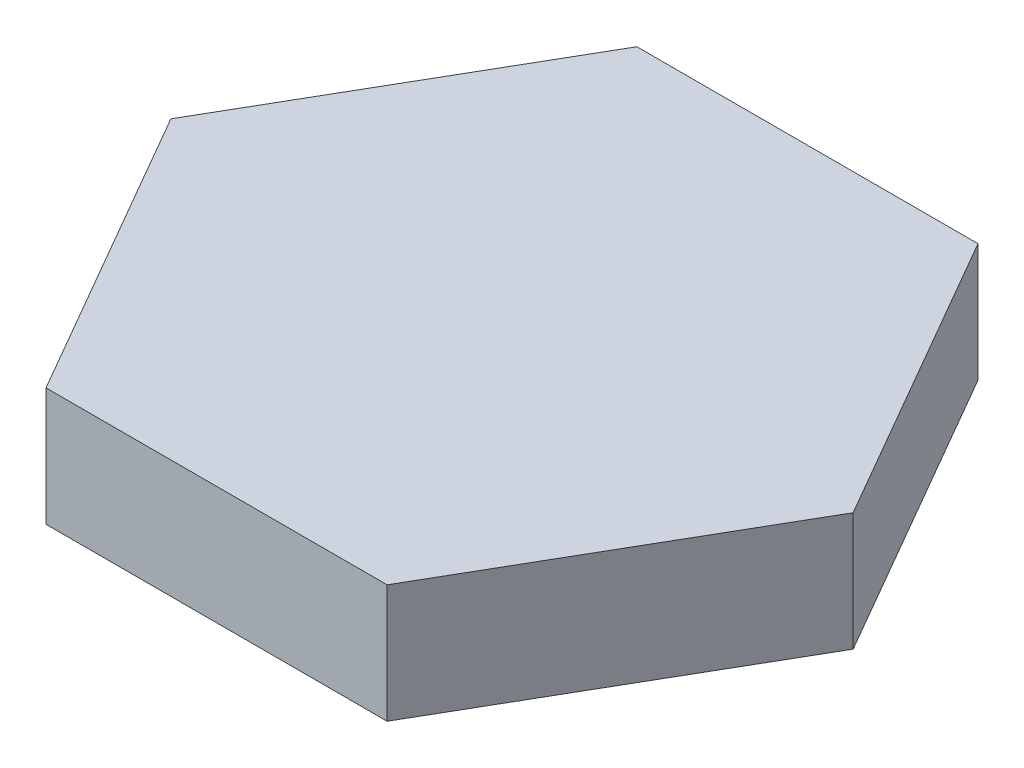
from build123d import *

# Parameters (mm, degrees)
EXTRUDE1_DEPTH = 10


with BuildPart() as part:
    # Sketch1 → Extrude1 (new body)
    with BuildSketch(Plane(origin=(0, 0, 0), x_dir=(1, 0, 0), z_dir=(0, 1, 0))):
        Polygon((-14.43375673, 25), (-28.867513459, 0), (-14.43375673, -25), (14.43375673, -25), (28.867513459, 0), (14.43375673, 25), align=None)
    extrude(amount=EXTRUDE1_DEPTH)


solid = part.part
